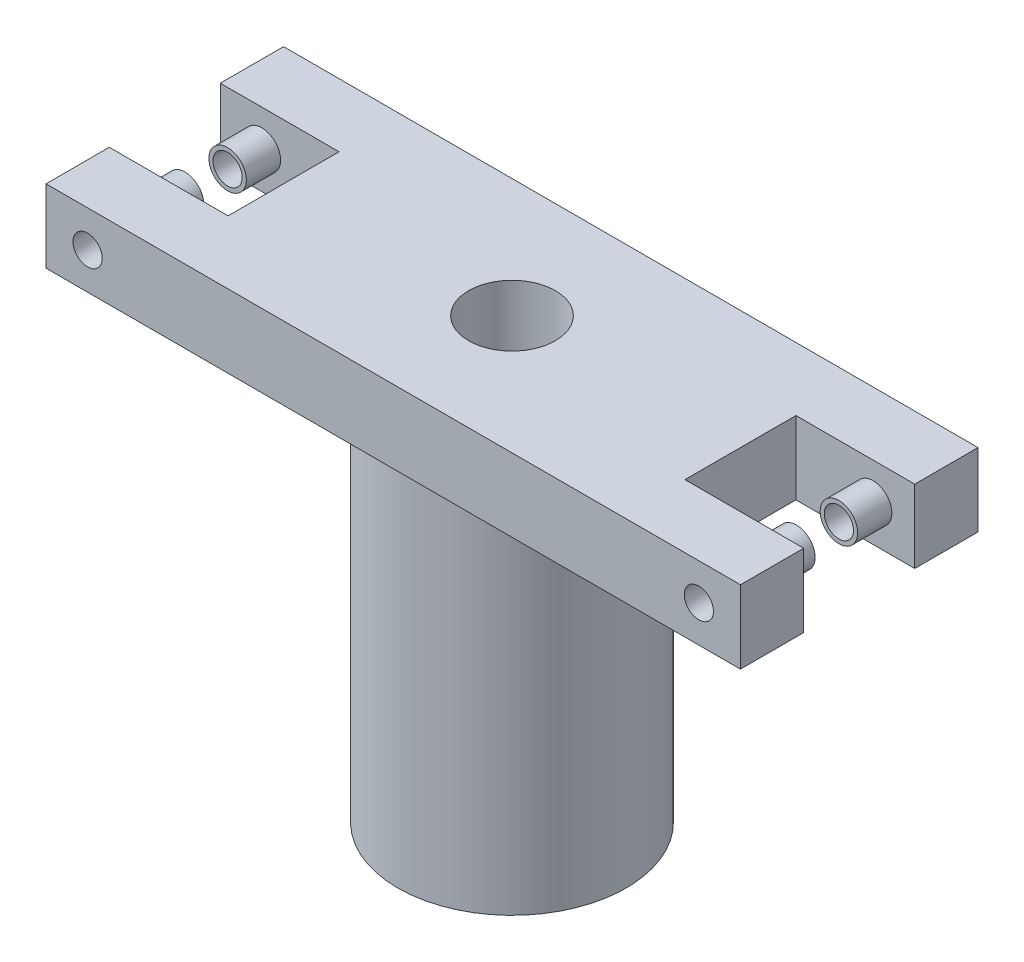
from build123d import *

# Parameters (mm, degrees)
SKETCH_10_R         = 12.5
EXTRUDE_5_DEPTH     = 40
CUT_EXTRUDE_1_DEPTH = 11
SKETCH_12_R         = 4.75
CUT_EXTRUDE_2_DEPTH = 18
SKETCH_13_R         = 2.1
CUT_EXTRUDE_3_DEPTH = 20
SKETCH_14_W         = 76
SKETCH_14_H         = 26
EXTRUDE_8_DEPTH     = 8
SKETCH_15_R         = 4.75
CUT_EXTRUDE_4_DEPTH = 8
SKETCH_16_R         = 1.6
CUT_EXTRUDE_5_DEPTH = 26
SKETCH_17_W         = 13
SKETCH_17_H         = 12.15
CUT_EXTRUDE_6_DEPTH = 8
SKETCH_18_R         = 2.05
SKETCH_18_R_2       = 1.6
EXTRUDE_9_DEPTH     = 3.75
EXTRUDE_START       = 3.75
SKETCH_19_R         = 2.05
SKETCH_19_R_2       = 1.6
EXTRUDE_10_DEPTH    = 3.75
SKETCH_20_R         = 2.05
SKETCH_20_R_2       = 1.6
EXTRUDE_11_DEPTH    = 3.75
SKETCH_21_R         = 2.05
SKETCH_21_R_2       = 1.6
EXTRUDE_12_DEPTH    = 3.75
CUT_EXTRUDE_7_DEPTH = 2.5


with BuildPart() as part:
    # 草图10 → 凸台-拉伸5 (new body)
    with BuildSketch(Plane(origin=(0, 0, 0), x_dir=(1, 0, 0), z_dir=(0, 1, 0))):
        with Locations(Location((0, 0, 0), (0, 0, 270))):
            Circle(SKETCH_10_R)
    extrude(amount=EXTRUDE_5_DEPTH)

    # 草图11 → 切除-拉伸1 (cut)
    with BuildSketch(Plane(origin=(0, 0, 0), x_dir=(-1, 0, 0), z_dir=(0, -1, 0))):
        Polygon((5.739953665, -4.542612896), (6.803995, 2.699639243), (1.064041335, 7.242252139), (-5.739953665, 4.542612896), (-6.803995, -2.699639243), (-1.064041335, -7.242252139), align=None)
    extrude(amount=-CUT_EXTRUDE_1_DEPTH, mode=Mode.SUBTRACT)

    # 草图12 → 切除-拉伸2 (cut)
    with BuildSketch(Plane(origin=(0, 40, 0), x_dir=(1, 0, 0), z_dir=(0, 1, 0))):
        with Locations(Location((0, 0, 0), (0, 0, 270))):
            Circle(SKETCH_12_R)
    extrude(amount=-CUT_EXTRUDE_2_DEPTH, mode=Mode.SUBTRACT)

    # 草图13 → 切除-拉伸3 (cut)
    with BuildSketch(Plane(origin=(0, 22, 0), x_dir=(1, 0, 0), z_dir=(0, 1, 0))):
        with Locations(Location((0, 0, 0), (0, 0, 270))):
            Circle(SKETCH_13_R)
    extrude(amount=-CUT_EXTRUDE_3_DEPTH, mode=Mode.SUBTRACT)

    # 草图14 → 凸台-拉伸8 (add)
    with BuildSketch(Plane(origin=(0, 40, 0), x_dir=(1, 0, 0), z_dir=(0, 1, 0))):
        Rectangle(SKETCH_14_W, SKETCH_14_H)
    extrude(amount=EXTRUDE_8_DEPTH)

    # 草图15 → 切除-拉伸4 (cut)
    with BuildSketch(Plane(origin=(0, 48, 0), x_dir=(1, 0, 0), z_dir=(0, 1, 0))):
        with Locations(Location((0, 0, 0), (0, 0, 270))):
            Circle(SKETCH_15_R)
    extrude(amount=-CUT_EXTRUDE_4_DEPTH, mode=Mode.SUBTRACT)

    # 草图16 → 切除-拉伸5 (cut)
    with BuildSketch(Plane.XY.offset(13)):
        with Locations((-33.45, 44)):
            Circle(SKETCH_16_R)
        with Locations((33.45, 44)):
            Circle(SKETCH_16_R)
    extrude(amount=-CUT_EXTRUDE_5_DEPTH, mode=Mode.SUBTRACT)

    # 草图17 → 切除-拉伸6 (cut)
    with BuildSketch(Plane.XZ.offset(-40)):
        with Locations((31.5, 0)):
            Rectangle(SKETCH_17_W, SKETCH_17_H)
        with Locations((-31.5, 0)):
            Rectangle(SKETCH_17_W, SKETCH_17_H)
    extrude(amount=-CUT_EXTRUDE_6_DEPTH, mode=Mode.SUBTRACT)

    # 草图18 → 凸台-拉伸9 (add)
    with BuildSketch(Plane(origin=(0, 0, 6.075), x_dir=(-1, 0, 0), z_dir=(0, 0, -1))):
        with Locations(Location((33.45, 44, 0), (0, 0, 180))):
            Circle(SKETCH_18_R)
        with Locations(Location((33.45, 44, 0), (0, 0, 180))):
            Circle(SKETCH_18_R_2, mode=Mode.SUBTRACT)
    extrude(amount=EXTRUDE_9_DEPTH)

    # 草图19 → 凸台-拉伸10 (add)
    with BuildSketch(Plane.XY.offset(-6.075).offset(EXTRUDE_START)):
        with Locations((-33.45, 44)):
            Circle(SKETCH_19_R)
        with Locations((-33.45, 44)):
            Circle(SKETCH_19_R_2, mode=Mode.SUBTRACT)
    extrude(amount=-EXTRUDE_10_DEPTH)

    # 草图20 → 凸台-拉伸11 (add)
    with BuildSketch(Plane.XY.offset(-6.075).offset(EXTRUDE_START)):
        with Locations(Location((33.45, 44, 0), (0, 0, 180))):
            Circle(SKETCH_20_R)
        with Locations((33.45, 44)):
            Circle(SKETCH_20_R_2, mode=Mode.SUBTRACT)
    extrude(amount=-EXTRUDE_11_DEPTH)

    # 草图21 → 凸台-拉伸12 (add)
    with BuildSketch(Plane(origin=(0, 0, 6.075), x_dir=(-1, 0, 0), z_dir=(0, 0, -1))):
        with Locations((-33.45, 44)):
            Circle(SKETCH_21_R)
        with Locations(Location((-33.45, 44, 0), (0, 0, 180))):
            Circle(SKETCH_21_R_2, mode=Mode.SUBTRACT)
    extrude(amount=EXTRUDE_12_DEPTH)

    # 草图22 → 切除-拉伸7 (cut)
    with BuildSketch(Plane(origin=(0, 0, -13), x_dir=(-1, 0, 0), z_dir=(0, 0, -1))):
        Polygon((-30.05, 44), (-31.75, 46.944486373), (-35.15, 46.944486373), (-36.85, 44), (-35.15, 41.055513627), (-31.75, 41.055513627), align=None)
        Polygon((36.85, 44), (35.15, 46.944486373), (31.75, 46.944486373), (30.05, 44), (31.75, 41.055513627), (35.15, 41.055513627), align=None)
    extrude(amount=-CUT_EXTRUDE_7_DEPTH, mode=Mode.SUBTRACT)


solid = part.part
